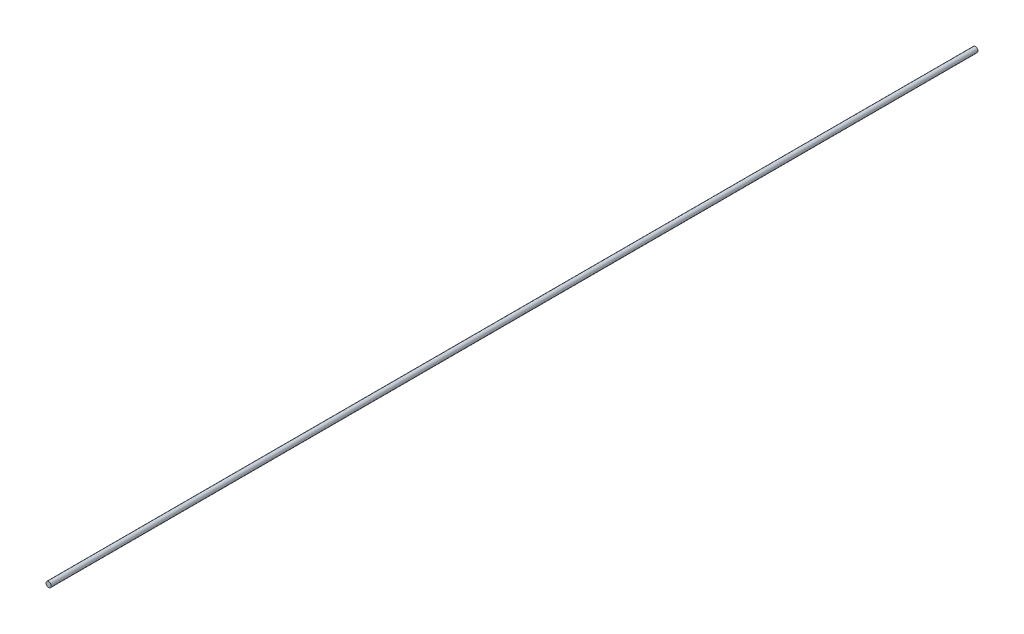
from build123d import *

# Parameters (mm, degrees)
SKETCH1_R           = 12.7
BOSS_EXTRUDE1_DEPTH = 4488.550503816


with BuildPart() as part:
    # Sketch1 → Boss-Extrude1 (new body)
    with BuildSketch(Plane.XY):
        Circle(SKETCH1_R)
    extrude(amount=BOSS_EXTRUDE1_DEPTH)


solid = part.part
